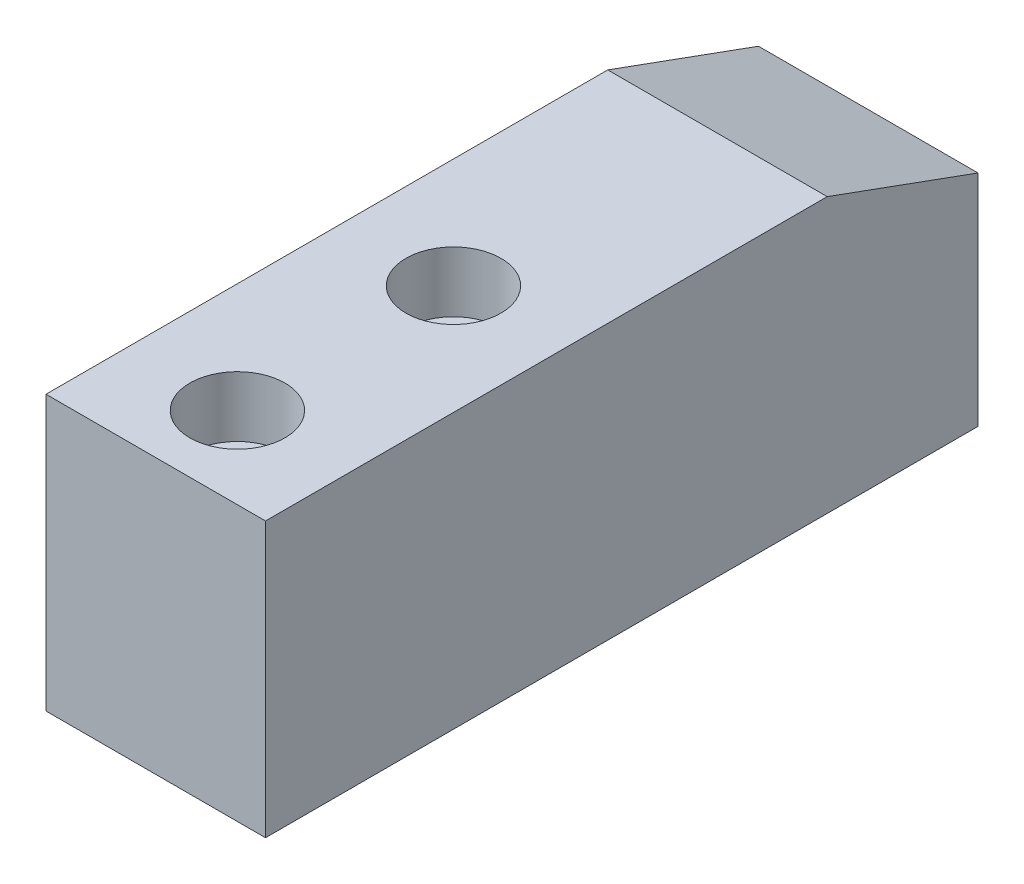
from build123d import *

# Parameters (mm, degrees)
BOSS_EXTRUDE1_DEPTH                                 = 12.7
CBORE_FOR_M6_HEX_SOCKET_HEAD_CAP_SCREW1_D           = 6.6
CBORE_FOR_M6_HEX_SOCKET_HEAD_CAP_SCREW1_CBORE_D     = 11
CBORE_FOR_M6_HEX_SOCKET_HEAD_CAP_SCREW1_CBORE_DEPTH = 7


with BuildPart() as part:
    # Sketch1 → Boss-Extrude1 (new, symmetric)
    with BuildSketch(Plane(origin=(0, 0, 0), x_dir=(0, 0, -1), z_dir=(1, 0, 0))):
        Polygon((0, 0), (82.446481614, 0), (82.446481614, 25.4), (65, 31.75), (0, 31.75), align=None)
    extrude(amount=BOSS_EXTRUDE1_DEPTH, both=True)

    # CBORE for M6 Hex Socket Head Cap Screw1 (through all)
    with Locations(Plane(origin=(0, 31.75, 0), x_dir=(1, 0, 0), z_dir=(0, 1, 0))):
        with Locations((0, 9.446481614), (0, 34.446481614)):
            CounterBoreHole(CBORE_FOR_M6_HEX_SOCKET_HEAD_CAP_SCREW1_D / 2, CBORE_FOR_M6_HEX_SOCKET_HEAD_CAP_SCREW1_CBORE_D / 2, CBORE_FOR_M6_HEX_SOCKET_HEAD_CAP_SCREW1_CBORE_DEPTH)


solid = part.part
